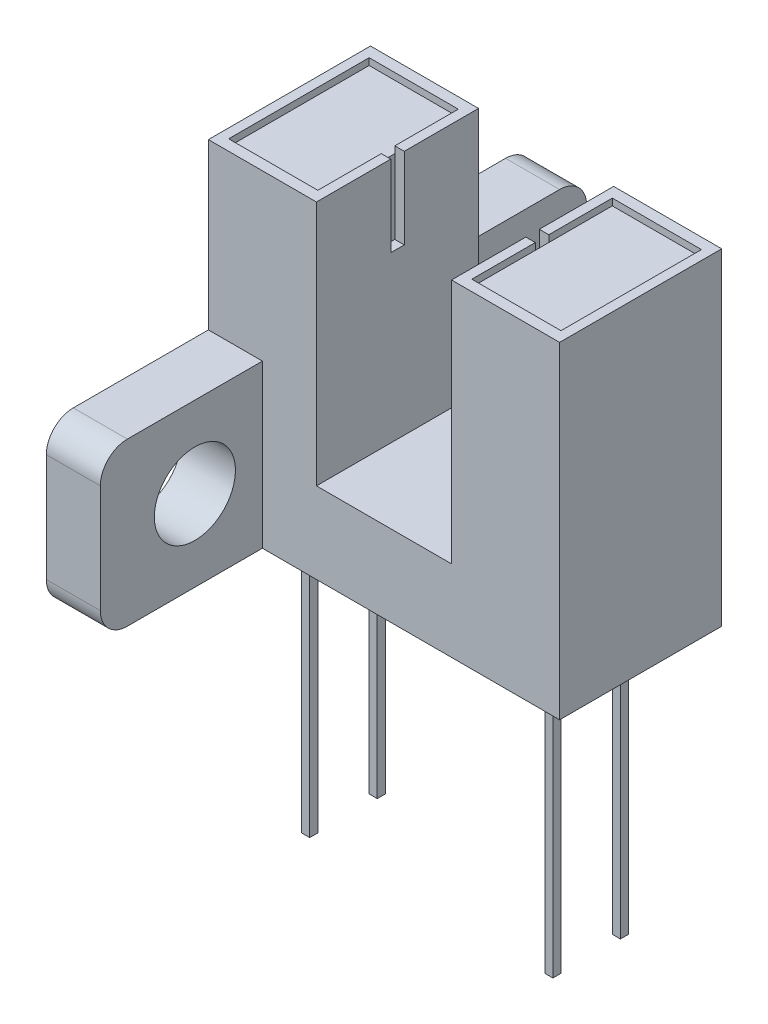
from build123d import *

# Parameters (mm, degrees)
BOSS_EXTRUDE1_DEPTH  = 3
SKETCH3_W            = 18
SKETCH3_H            = 6
BOSS_EXTRUDE2_DEPTH  = 2
SKETCH4_R            = 1.5
CUT_EXTRUDE1_DEPTH   = 20.910047715
FILLET1_R            = 1
SKETCH5_W            = 3.3
SKETCH5_H            = 5.2
CUT_EXTRUDE2_DEPTH   = 0.25
SKETCH6_W            = 0.5
SKETCH6_H            = 3
CUT_EXTRUDE3_DEPTH   = 0.35
SKETCH7_W            = 12
SKETCH7_H            = 5
CUT_EXTRUDE4_DEPTH   = 2
SKETCH8_W            = 0.3
SKETCH8_H            = 0.3
BOSS_EXTRUDE3_DEPTH  = 12
LPATTERN1_COUNT      = 2
LPATTERN1_PITCH      = 9
LPATTERN1_COUNT_DIR2 = 2
LPATTERN1_PITCH_DIR2 = 2.5


with BuildPart() as part:
    # Sketch1 → Boss-Extrude1 (new, symmetric)
    with BuildSketch(Plane.XY):
        Polygon((-9, 12.1), (-13, 12.1), (-13, 0), (0, 0), (0, 12.1), (-4, 12.1), (-4, 3), (-9, 3), align=None)
    extrude(amount=BOSS_EXTRUDE1_DEPTH, both=True)

    # Sketch3 → Boss-Extrude2 (add)
    with BuildSketch(Plane.ZY.offset(13)):
        with Locations((0, 3)):
            Rectangle(SKETCH3_W, SKETCH3_H)
    extrude(amount=-BOSS_EXTRUDE2_DEPTH)

    # Sketch4 → Cut-Extrude1 (cut, through all)
    with BuildSketch(Plane.ZY.offset(13)):
        with Locations((-5.5, 3)):
            Circle(SKETCH4_R)
        with Locations((5.5, 3)):
            Circle(SKETCH4_R)
    extrude(amount=-CUT_EXTRUDE1_DEPTH, mode=Mode.SUBTRACT)

    # Fillet1
    fillet1_edges = [part.edges().sort_by_distance(p)[0] for p in [
        (-12, 6, -9),
        (-12, 0, -9),
        (-12, 6, 9),
        (-12, 0, 9),
    ]]
    fillet(fillet1_edges, radius=FILLET1_R)

    # Sketch5 → Cut-Extrude2 (cut)
    with BuildSketch(Plane(origin=(0, 12.1, 0), x_dir=(1, 0, 0), z_dir=(0, 1, 0))):
        with Locations((-11, 0)):
            Rectangle(SKETCH5_W, SKETCH5_H)
    cut_extrude2 = extrude(amount=-CUT_EXTRUDE2_DEPTH, mode=Mode.SUBTRACT)

    # Sketch6 → Cut-Extrude3 (cut)
    with BuildSketch(Plane(origin=(-9, 0, 0), x_dir=(0, 0, -1), z_dir=(1, 0, 0))):
        with Locations((0, 10.6)):
            Rectangle(SKETCH6_W, SKETCH6_H)
    cut_extrude3 = extrude(amount=-CUT_EXTRUDE3_DEPTH, mode=Mode.SUBTRACT)

    # Mirror1: Cut-Extrude2, Cut-Extrude3 across plane
    add(cut_extrude2.mirror(Plane(origin=(-6.5, 0, 0), x_dir=(0, 0, 1), z_dir=(1, 0, 0))), mode=Mode.SUBTRACT)
    add(cut_extrude3.mirror(Plane(origin=(-6.5, 0, 0), x_dir=(0, 0, 1), z_dir=(1, 0, 0))), mode=Mode.SUBTRACT)

    # Sketch7 → Cut-Extrude4 (cut)
    with BuildSketch(Plane.XZ):
        with Locations((-6.5, 0)):
            Rectangle(SKETCH7_W, SKETCH7_H)
    extrude(amount=-CUT_EXTRUDE4_DEPTH, mode=Mode.SUBTRACT)

    # Sketch8 → Boss-Extrude3 (add)
    with BuildSketch(Plane.XZ.offset(-2)):
        with Locations((-11, 1.25)):
            Rectangle(SKETCH8_W, SKETCH8_H)
    boss_extrude3 = extrude(amount=BOSS_EXTRUDE3_DEPTH)

    # LPattern1: Boss-Extrude3 2 × 2
    with Locations(*[(i * LPATTERN1_PITCH, 0, -j * LPATTERN1_PITCH_DIR2) for i in range(LPATTERN1_COUNT) for j in range(LPATTERN1_COUNT_DIR2) if (i, j) != (0, 0)]):
        add(boss_extrude3)


solid = part.part
